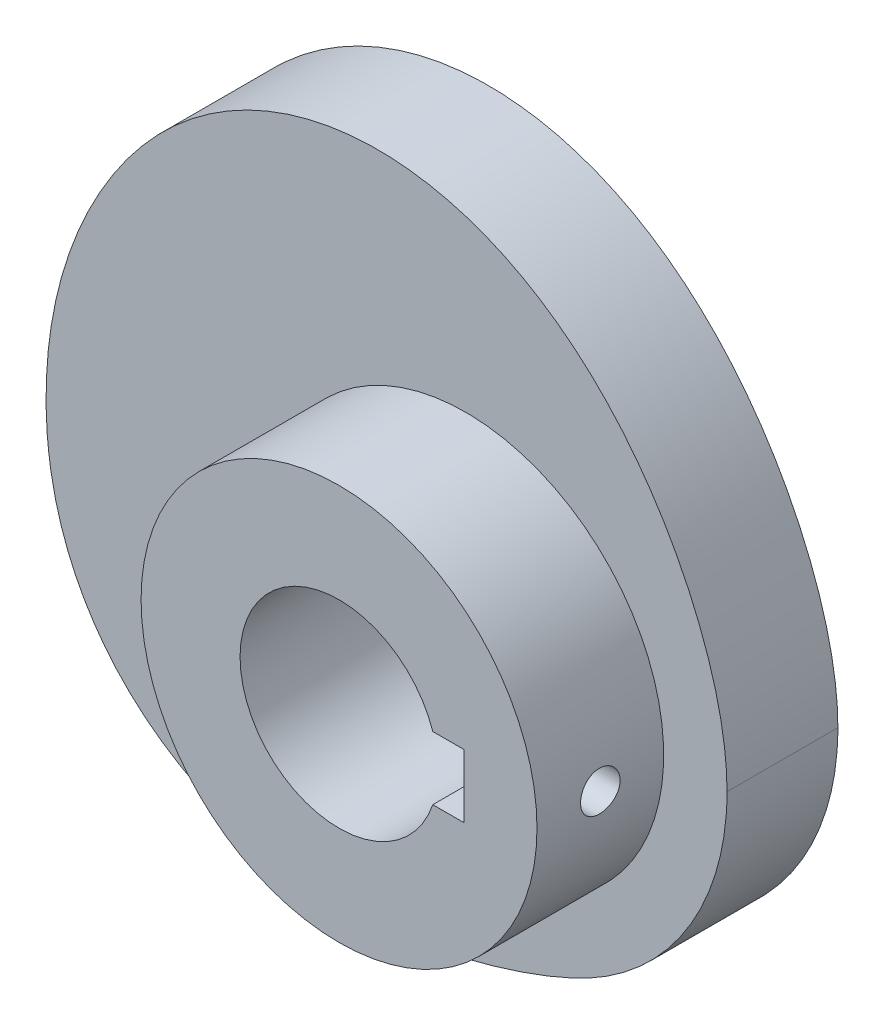
from build123d import *

# Parameters (mm, degrees)
EXTRUDE_1_DEPTH     = 14
SKETCH_2_R          = 25
EXTRUDE_2_DEPTH     = 30
SKETCH_3_R          = 12.5
CUT_EXTRUDE_1_DEPTH = 78.64562782
SWEEP_2_PROFILE_R   = 2.5
SKETCH_8_W          = 15.8
SKETCH_8_H          = 8
CUT_EXTRUDE_3_DEPTH = 78.64562782


with BuildPart() as part:
    # 草图1 → 凸台-拉伸1 (new body)
    with BuildSketch(Plane.XY):
        with BuildLine():
            add(Edge.make_bspline(
                [(33, 0), (32.992204895, 0.544666729), (32.976480109, 1.643403319), (32.853064931, 3.301727765), (32.658915426, 4.980879695), (32.388196689, 6.677537715), (32.044944958, 8.388606268), (31.630570565, 10.111165253), (31.147186794, 11.842433965), (30.596568938, 13.57971361), (29.98033344, 15.320337013), (29.299789777, 17.061615147), (28.555887029, 18.800784535), (27.749173646, 20.534967231), (26.879751228, 22.261119957), (25.947286594, 23.976001144), (24.951020471, 25.676125073), (23.889814679, 27.35772059), (22.762223009, 29.016688558), (21.566586312, 30.648565024), (20.301138192, 32.248479161), (18.964127555, 33.81112609), (17.553956129, 35.330754232), (16.069306796, 36.801162963), (14.509273248, 38.215722303), (12.873484417, 39.567416225), (11.162207045, 40.848898292), (9.376441015, 42.052578226), (7.517986505, 43.170717712), (5.589490091, 44.195539218), (3.594469744, 45.119346278), (1.53731504, 45.934646153), (-0.576735961, 46.634276616), (-2.74164203, 47.211518041), (-4.950619716, 47.660204084), (-7.196219851, 47.974828288), (-9.470422571, 48.150607487), (-11.76473259, 48.183580117), (-14.070288761, 48.070629868), (-16.377971366, 47.809547695), (-18.67851562, 47.399040683), (-20.96262116, 46.838742341), (-23.221064088, 46.12921357), (-25.444800735, 45.271912976), (-27.625072088, 44.269170741), (-29.753502784, 43.124146476), (-31.822186889, 41.840759247), (-33.823775568, 40.423630812), (-35.751543622, 38.877994203), (-37.599456194, 37.209613013), (-39.362201277, 35.424668235), (-41.035231852, 33.529668236), (-42.614754199, 31.53132517), (-44.09777446, 29.436479773), (-45.481085646, 27.253115728), (-46.760721786, 24.993714386), (-47.930689696, 22.669528818), (-48.985280232, 20.290366962), (-49.921879744, 17.86233444), (-50.73821056, 15.391267947), (-51.432305812, 12.8831224), (-52.002502766, 10.343940159), (-52.447402955, 7.779839842), (-52.766015438, 5.196990334), (-52.957281079, 2.601648936), (-53.021584789, 0.009188241), (-52.95682309, -2.556762808), (-52.768752296, -5.077096398), (-52.522148692, -6.726622939), (-52.399929, -7.544148)],
                knots=[0, 0, 0, 0, 0.010895628, 0.021979359, 0.033249847, 0.044704843, 0.056341204, 0.068154912, 0.080141086, 0.092294104, 0.104607701, 0.11707519, 0.129689707, 0.14244447, 0.155333078, 0.168349762, 0.181489545, 0.194748369, 0.208123105, 0.221611441, 0.235211792, 0.248923032, 0.26274432, 0.276674885, 0.290713819, 0.304859987, 0.319111923, 0.333467808, 0.347925543, 0.362482829, 0.377137264, 0.391886521, 0.406728484, 0.421661423, 0.436684102, 0.451795886, 0.466996829, 0.482287719, 0.497670025, 0.513145895, 0.528718049, 0.54438967, 0.560164277, 0.576045576, 0.592037302, 0.608143104, 0.624366387, 0.640710242, 0.657177353, 0.673769958, 0.690489849, 0.70733837, 0.724316458, 0.741424727, 0.758663496, 0.776003856, 0.793351474, 0.810699088, 0.828046707, 0.845394323, 0.862741936, 0.880089557, 0.897437174, 0.914784793, 0.932132405, 0.949480024, 0.966642526, 0.983467637, 1, 1, 1, 1], degree=3))
            add(Edge.make_bspline(
                [(-52.399929, -7.544148), (-52.251447511, -8.344449933), (-51.956477891, -9.93430977), (-51.431378847, -11.881327743), (-50.946615492, -13.402352601), (-50.547774852, -14.520833098), (-50.113968755, -15.61972104), (-49.645210909, -16.698158038), (-49.141976069, -17.755310038), (-48.604716766, -18.790320175), (-48.033993716, -19.80233339), (-47.430434687, -20.790495875), (-46.794737646, -21.753963168), (-46.127681435, -22.691905033), (-45.430091118, -23.603527112), (-44.461690461, -24.78142675), (-43.179240858, -26.184980253), (-41.532569131, -27.753864704), (-39.788936475, -29.201085533), (-37.95827815, -30.522875718), (-36.050936512, -31.716585493), (-34.077553488, -32.780697635), (-32.048834528, -33.714886161), (-29.975350706, -34.520036776), (-27.867326416, -35.19822348), (-25.734442747, -35.752653633), (-23.585659114, -36.187574089), (-21.429063355, -36.50814968), (-19.27176002, -36.720310246), (-17.119804246, -36.830595085), (-14.978186003, -36.845970949), (-12.850873113, -36.773654705), (-10.740913687, -36.620937922), (-8.650597875, -36.395022526), (-6.581674525, -36.102863407), (-4.535611161, -35.751026937), (-2.513887786, -35.345556209), (-0.518293788, -34.891856115), (1.448781863, -34.394574738), (3.384105738, -33.857530642), (5.283395004, -33.283637208), (7.141181014, -32.67491492), (8.950717416, -32.03256093), (10.703916152, -31.357116), (12.391331701, -30.648817619), (14.002048983, -29.907900792), (15.525340793, -29.134972637), (16.967203751, -28.319820567), (18.341157037, -27.449470169), (19.665980256, -26.516508819), (20.943385245, -25.51958757), (22.170348028, -24.461209886), (23.343896741, -23.343896621), (24.461208994, -22.170347615), (25.519591016, -20.943387015), (26.516495927, -19.665973587), (27.449518295, -18.341181942), (28.316413718, -16.972205388), (29.115091885, -15.562340777), (29.843629808, -14.114985263), (30.500271052, -12.633625806), (31.083435636, -11.121830348), (31.591710671, -9.583242061), (32.023907296, -8.021566688), (32.37884622, -6.440566847), (32.656192002, -4.844051032), (32.853335771, -3.23586502), (32.977041039, -1.619883695), (32.992347014, -0.539961135), (33, 0)],
                knots=[0, 0, 0, 0, 0.020431005, 0.040587725, 0.050576924, 0.060511834, 0.070396638, 0.08023526, 0.09003139, 0.099788458, 0.109509648, 0.119197921, 0.128855969, 0.138486254, 0.14809097, 0.157672096, 0.176767364, 0.195785952, 0.214735199, 0.233619037, 0.252438345, 0.271191379, 0.289874288, 0.308481685, 0.327007235, 0.345444275, 0.363786425, 0.382028051, 0.400164732, 0.418193505, 0.436112913, 0.453922863, 0.47162413, 0.489217593, 0.50670321, 0.524078705, 0.54133817, 0.558470582, 0.575458641, 0.592277781, 0.60889569, 0.625272245, 0.641359738, 0.657103167, 0.672440382, 0.687301883, 0.701610051, 0.715317718, 0.728874017, 0.74243031, 0.75598661, 0.769542915, 0.783099211, 0.796655507, 0.810211812, 0.823768112, 0.837324405, 0.850880704, 0.86443701, 0.877993308, 0.891549609, 0.905105906, 0.918662207, 0.932218502, 0.945774799, 0.959331099, 0.972887398, 0.986443703, 1, 1, 1, 1], degree=3))
        make_face()
    extrude(amount=EXTRUDE_1_DEPTH)

    # 草图2 → 凸台-拉伸2 (add)
    with BuildSketch(Plane.XY):
        with Locations(Location((0, 0, 0), (0, 0, 180))):
            Circle(SKETCH_2_R)
    extrude(amount=EXTRUDE_2_DEPTH)

    # 草图3 → 切除-拉伸1 (cut, through all)
    with BuildSketch(Plane.XY.offset(30)):
        Circle(SKETCH_3_R)
    extrude(amount=-CUT_EXTRUDE_1_DEPTH, mode=Mode.SUBTRACT)

    # 切除-扫描2: sweep along a curve in space
    with BuildLine() as sweep_2_path:
        Line((0, 0, 22), (27, 0, 22))
    # 切除-扫描2 profile (on start of the path) → 切除-扫描2 (sweep, cut)
    with BuildSketch(Plane(origin=(0, 0, 22), x_dir=(0, 0, 1), z_dir=(1, 0, 0))):
        Circle(SWEEP_2_PROFILE_R)
    sweep(path=sweep_2_path.line, mode=Mode.SUBTRACT)

    # 草图8 → 切除-拉伸3 (cut, through all)
    with BuildSketch(Plane.XY):
        with Locations((7.9, 0)):
            Rectangle(SKETCH_8_W, SKETCH_8_H)
    extrude(amount=CUT_EXTRUDE_3_DEPTH, mode=Mode.SUBTRACT)


solid = part.part
